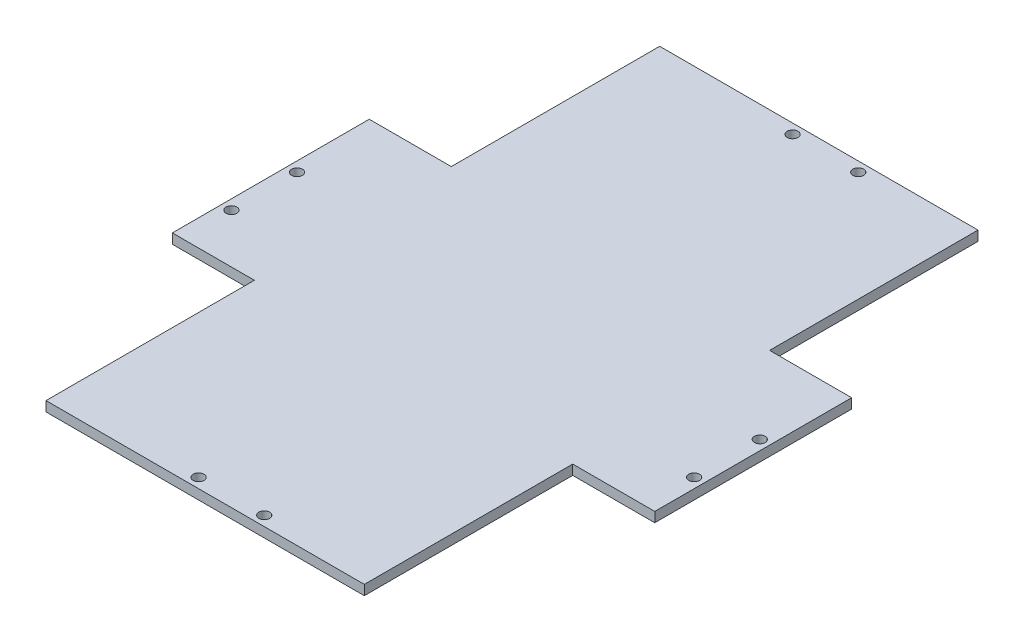
from build123d import *

# Parameters (mm, degrees)
SKETCH_1_W          = 97
SKETCH_1_H          = 187
EXTRUDE_1_DEPTH     = 3
SKETCH_4_W          = 25
SKETCH_4_H          = 60
EXTRUDE_2_DEPTH     = 3
SKETCH_6_R          = 1.65
CUT_EXTRUDE_5_DEPTH = 3


with BuildPart() as part:
    # 草图1 → 凸台-拉伸1 (new body)
    with BuildSketch(Plane(origin=(0, 0, 0), x_dir=(1, 0, 0), z_dir=(0, 1, 0))):
        Rectangle(SKETCH_1_W, SKETCH_1_H)
    extrude(amount=EXTRUDE_1_DEPTH)

    # 草图4 → 凸台-拉伸2 (add)
    with BuildSketch(Plane(origin=(0, 3, 0), x_dir=(1, 0, 0), z_dir=(0, 1, 0))):
        with Locations((61, 0)):
            Rectangle(SKETCH_4_W, SKETCH_4_H)
    extrude_2 = extrude(amount=-EXTRUDE_2_DEPTH)

    # 镜向1: 凸台-拉伸2 across plane
    add(extrude_2.mirror(Plane(origin=(0, 0, 0), x_dir=(0, 0, 1), z_dir=(1, 0, 0))))

    # 草图6 → 切除-拉伸5 (cut)
    with BuildSketch(Plane(origin=(0, 3, 0), x_dir=(1, 0, 0), z_dir=(0, 1, 0))):
        with Locations(Location((-5, -90.5, 0), (0, 0, 270))):
            Circle(SKETCH_6_R)
        with Locations(Location((15, -90.5, 0), (0, 0, 270))):
            Circle(SKETCH_6_R)
        with Locations(Location((70.5, -15, 0), (0, 0, 270))):
            Circle(SKETCH_6_R)
        with Locations(Location((70.5, 5, 0), (0, 0, 270))):
            Circle(SKETCH_6_R)
        with Locations(Location((15, 90.5, 0), (0, 0, 270))):
            Circle(SKETCH_6_R)
        with Locations(Location((-5, 90.5, 0), (0, 0, 270))):
            Circle(SKETCH_6_R)
        with Locations(Location((-70.5, -15, 0), (0, 0, 270))):
            Circle(SKETCH_6_R)
        with Locations(Location((-70.5, 5, 0), (0, 0, 270))):
            Circle(SKETCH_6_R)
    extrude(amount=-CUT_EXTRUDE_5_DEPTH, mode=Mode.SUBTRACT)


solid = part.part
